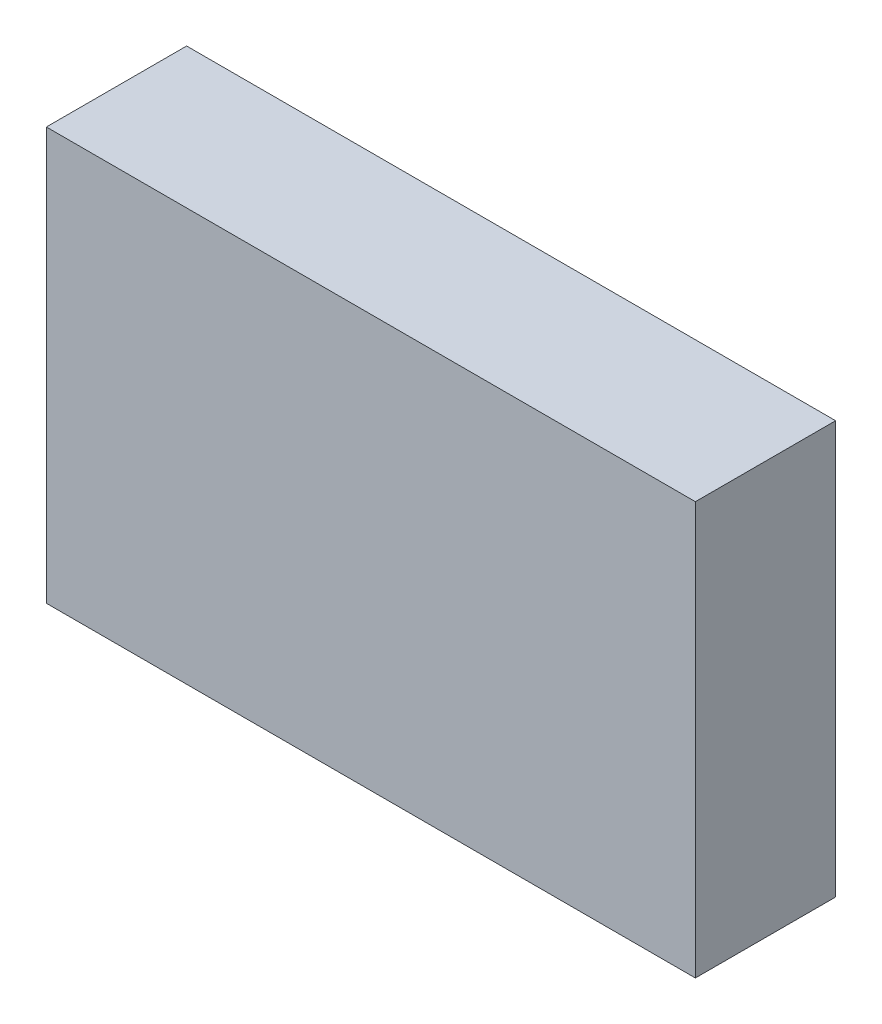
from build123d import *

# Parameters (mm, degrees)
SKETCH1_W           = 118
SKETCH1_H           = 75
BOSS_EXTRUDE1_DEPTH = 25.5


with BuildPart() as part:
    # Sketch1 → Boss-Extrude1 (new body)
    with BuildSketch(Plane.XY):
        with Locations((5.613592233, 3.857281553)):
            Rectangle(SKETCH1_W, SKETCH1_H)
    extrude(amount=BOSS_EXTRUDE1_DEPTH)


solid = part.part
